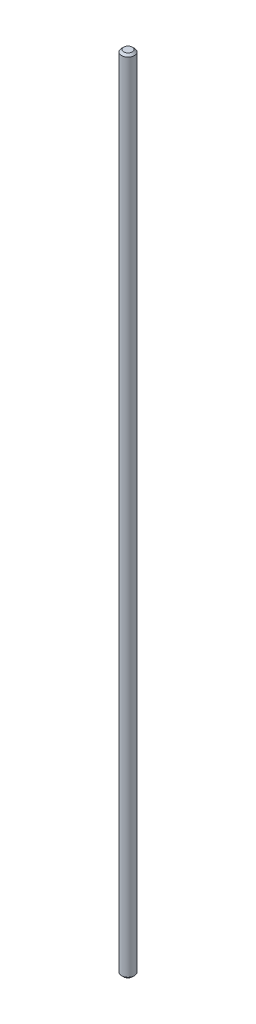
from build123d import *

# Parameters (mm, degrees)
SKETCH_1_R      = 3000
EXTRUDE_1_DEPTH = 375000
CHAMFER_1_SIZE  = 1000


with BuildPart() as part:
    # 草圖1 → 填料-伸長1 (new body)
    with BuildSketch(Plane(origin=(0, 0, 0), x_dir=(1, 0, 0), z_dir=(0, 1, 0))):
        with Locations(Location((0, 0, 0), (0, 0, 270))):
            Circle(SKETCH_1_R)
    extrude(amount=EXTRUDE_1_DEPTH)

    # 導角1
    chamfer_1_edges = [part.edges().sort_by_distance(p)[0] for p in [
        (0, 0, -3000),
        (0, 375000, -3000),
    ]]
    chamfer(chamfer_1_edges, length=CHAMFER_1_SIZE)


solid = part.part
